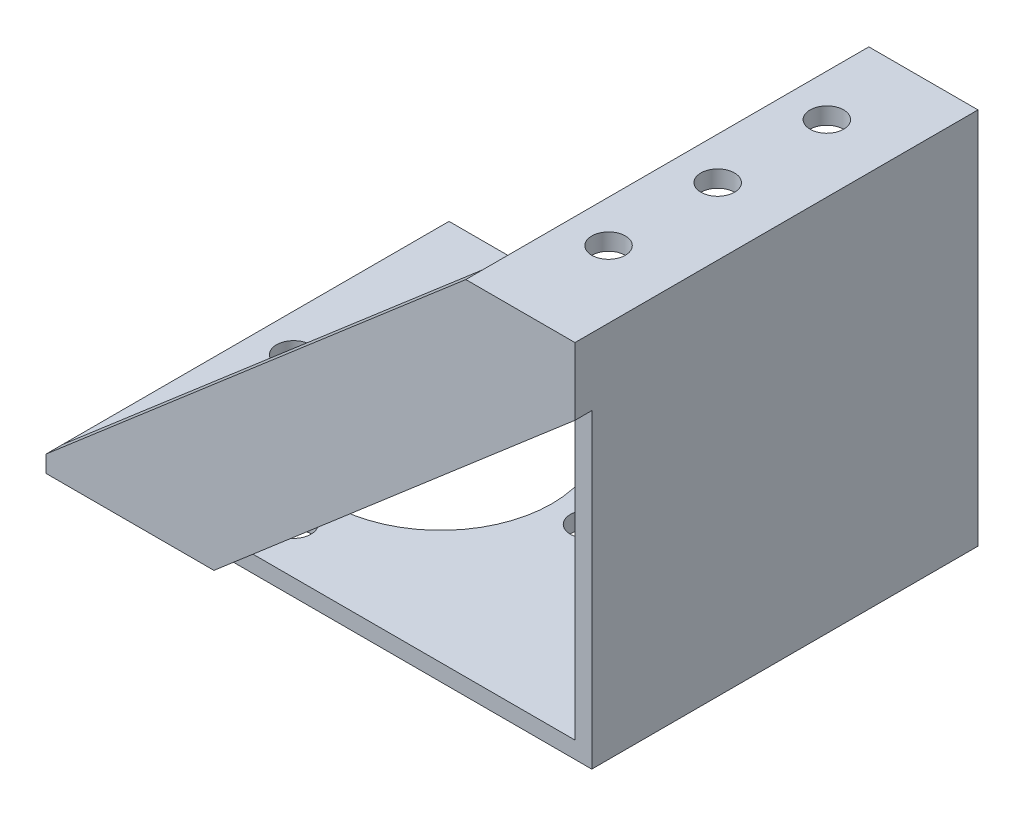
from build123d import *

# Parameters (mm, degrees)
BOSS_EXTRUDE1_DEPTH = 46
SKETCH2_R           = 13.25
SKETCH2_R_2         = 2.05
CUT_EXTRUDE1_DEPTH  = 2
SKETCH3_R           = 2
CUT_EXTRUDE2_DEPTH  = 100
BOSS_EXTRUDE2_DEPTH = 2


with BuildPart() as part:
    # Sketch1 → Boss-Extrude1 (new body)
    with BuildSketch(Plane.XY):
        Polygon((0, 0), (0, 45), (-13, 45), (-13, 43), (-2, 43), (-2, 2), (-63, 2), (-63, 0), align=None)
    extrude(amount=BOSS_EXTRUDE1_DEPTH)

    # Sketch2 → Cut-Extrude1 (cut)
    with BuildSketch(Plane.XZ):
        with Locations(Location((-41, 23, 0), (0, 0, 270))):
            Circle(SKETCH2_R)
        with Locations(Location((-41, 40.5, 0), (0, 0, 270))):
            Circle(SKETCH2_R_2)
        with Locations(Location((-58.5, 23, 0), (0, 0, 270))):
            Circle(SKETCH2_R_2)
        with Locations(Location((-23.5, 23, 0), (0, 0, 270))):
            Circle(SKETCH2_R_2)
        with Locations(Location((-41, 5.5, 0), (0, 0, 270))):
            Circle(SKETCH2_R_2)
    extrude(amount=-CUT_EXTRUDE1_DEPTH, mode=Mode.SUBTRACT)

    # Sketch3 → Cut-Extrude2 (cut)
    with BuildSketch(Plane(origin=(0, 45, 0), x_dir=(1, 0, 0), z_dir=(0, 1, 0))):
        with Locations(Location((-8, -10, 0), (0, 0, 270))):
            Circle(SKETCH3_R)
        with Locations(Location((-8, -23, 0), (0, 0, 270))):
            Circle(SKETCH3_R)
        with Locations(Location((-8, -36, 0), (0, 0, 270))):
            Circle(SKETCH3_R)
    extrude(amount=-CUT_EXTRUDE2_DEPTH, mode=Mode.SUBTRACT)

    # Sketch4 → Boss-Extrude2 (add)
    with BuildSketch(Plane.XY.offset(46)):
        Polygon((-63, 2), (-13, 45), (0, 45), (0, 36.98), (-43, 0), (-63, 0), align=None)
    extrude(amount=BOSS_EXTRUDE2_DEPTH)


solid = part.part
